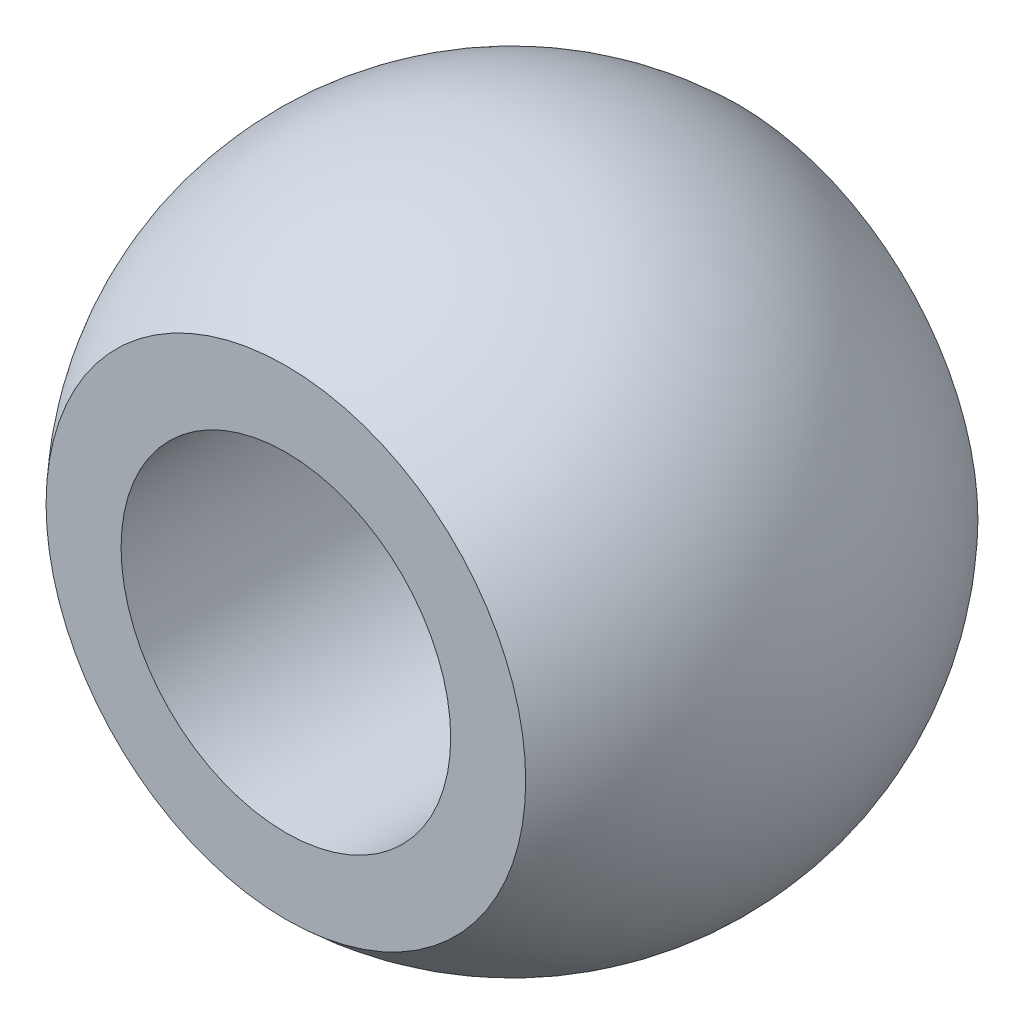
from build123d import *

# Parameters (mm, degrees)
SKETCH1_R               = 8.33374
EXTRUDE1_DEPTH          = 3.175
CUT_EXTRUDE1_DEPTH      = 14.417728087
CUT_EXTRUDE1_DEPTH_BACK = 14.417728087
SKETCH4_R               = 3.175
CUT_EXTRUDE2_DEPTH      = 14.417728087
CUT_EXTRUDE2_DEPTH_BACK = 14.417728087
SKETCH5_W               = 1.143161314
SKETCH5_H               = 16.66748
CHAMFER1_SIZE           = 0.5588


with BuildPart() as part:
    # Sketch1 → Extrude1 (new, symmetric)
    with BuildSketch(Plane.XY):
        Circle(SKETCH1_R)
    extrude(amount=EXTRUDE1_DEPTH, both=True)

    # Sketch2 → Cut-Revolve1 (revolve, cut)
    with BuildSketch(Plane.XY):
        with BuildLine():
            Line((0, 6.4135), (0, -6.4135))
            ThreePointArc((0, -6.4135), (6.4135, 0), (0, 6.4135))
        make_face()
    revolve(axis=Axis((0, 6.4135, 0), (0, 1, 0)), mode=Mode.SUBTRACT)

    # Chamfer1
    chamfer1_edges = [part.edges().sort_by_distance(p)[0] for p in [
        (-8.33374, 0, -3.175),
        (-8.33374, 0, 3.175),
    ]]
    chamfer(chamfer1_edges, length=CHAMFER1_SIZE)

    # Sketch8 → Cut-Revolve2 (revolve, cut)
    with BuildSketch(Plane(origin=(0, 0, 0), x_dir=(0, 0, -1), z_dir=(1, 0, 0)), mode=Mode.PRIVATE) as cut_revolve2_sk:
        Polygon((-0.84961036, 8.33374), (-0.48006, 7.69366), (0.48006, 7.69366), (0.84961036, 8.33374), align=None)
    revolve(cut_revolve2_sk.sketch.rotate(Axis((0, 0, 0), (0, 0, -1)), 90), axis=Axis((0, 0, 0), (0, 0, -1)), mode=Mode.SUBTRACT)


with BuildPart() as body_2:
    # Sketch3 → Revolve1 (revolve)
    with BuildSketch(Plane.XY):
        with BuildLine():
            Line((0, 6.35), (0, -6.35))
            ThreePointArc((0, -6.35), (6.35, 0), (0, 6.35))
        make_face()
    revolve(axis=Axis((0, 6.35, 0), (0, 1, 0)))

    # Sketch4 → Cut-Extrude1 (cut, two sides: drawn at the far end of the back side and taken through both)
    with BuildSketch(Plane.XY.offset(-CUT_EXTRUDE1_DEPTH_BACK)):
        with Locations(Location((0, 0, 0), (0, 0, 180))):
            Circle(SKETCH4_R)
    extrude(amount=CUT_EXTRUDE1_DEPTH + CUT_EXTRUDE1_DEPTH_BACK, mode=Mode.SUBTRACT)

    # Sketch5 → Cut-Extrude2 (cut, two sides: drawn at the far end of the back side and taken through both)
    with BuildSketch(Plane(origin=(0, 0, 0), x_dir=(0, 0, -1), z_dir=(1, 0, 0)).offset(-CUT_EXTRUDE2_DEPTH_BACK)):
        with Locations((-4.927680657, 0)):
            Rectangle(SKETCH5_W, SKETCH5_H)
        with Locations((4.927680657, 0)):
            Rectangle(SKETCH5_W, SKETCH5_H)
    extrude(amount=CUT_EXTRUDE2_DEPTH + CUT_EXTRUDE2_DEPTH_BACK, mode=Mode.SUBTRACT)


solid = body_2.part
